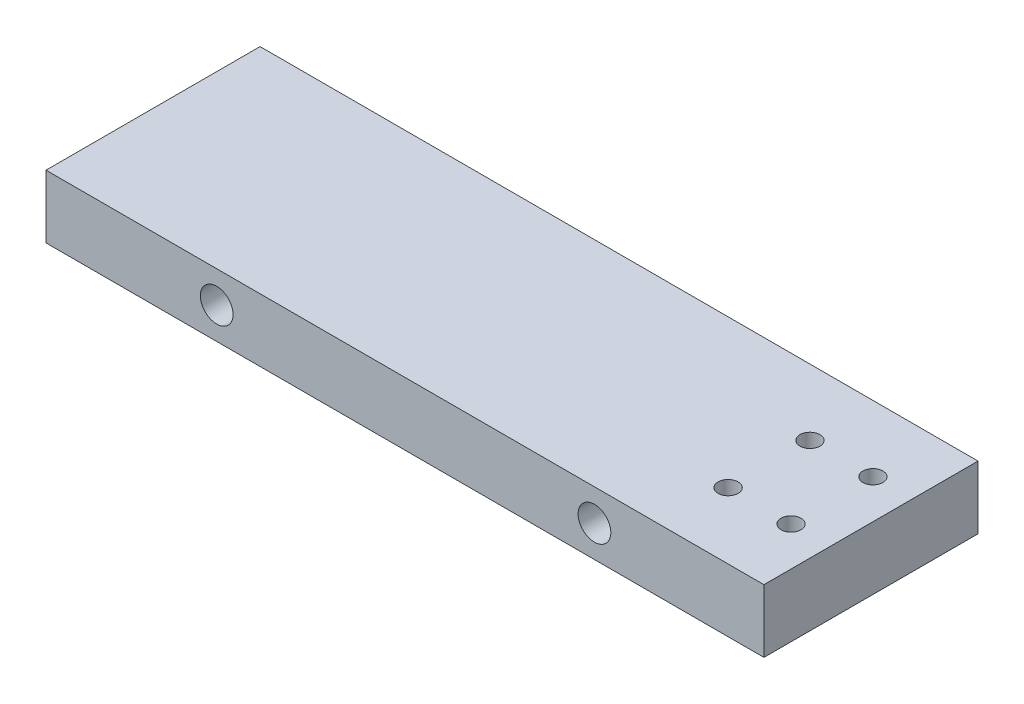
from build123d import *

# Parameters (mm, degrees)
SKETCH1_W           = 114.02881
SKETCH1_H           = 34
BOSS_EXTRUDE1_DEPTH = 10.01
SKETCH8_R           = 2.6
CUT_EXTRUDE3_DEPTH  = 120.410090068
SKETCH11_R          = 1.59
CUT_EXTRUDE6_DEPTH  = 120.410090068
SKETCH12_W          = 34
SKETCH12_H          = 10.01
BOSS_EXTRUDE2_DEPTH = 2.69
SKETCH14_W          = 34
SKETCH14_H          = 10.01
CUT_EXTRUDE7_DEPTH  = 2.69


with BuildPart() as part:
    # Sketch1 → Boss-Extrude1 (new body)
    with BuildSketch(Plane(origin=(0, 0, 0), x_dir=(1, 0, 0), z_dir=(0, 1, 0))):
        with Locations((57.014405, 17)):
            Rectangle(SKETCH1_W, SKETCH1_H)
    extrude(amount=BOSS_EXTRUDE1_DEPTH)

    # Sketch8 → Cut-Extrude3 (cut, through all)
    with BuildSketch(Plane(origin=(0, 0, -34), x_dir=(-1, 0, 0), z_dir=(0, 0, -1))):
        with Locations((-89.8, 5)):
            Circle(SKETCH8_R)
        with Locations((-29.8, 5)):
            Circle(SKETCH8_R)
    extrude(amount=-CUT_EXTRUDE3_DEPTH, mode=Mode.SUBTRACT)

    # Sketch11 → Cut-Extrude6 (cut, through all)
    with BuildSketch(Plane(origin=(0, 10.01, 0), x_dir=(1, 0, 0), z_dir=(0, 1, 0))):
        with Locations(Location((110.52881, 10.5, 0), (0, 0, 270))):
            Circle(SKETCH11_R)
        with Locations(Location((110.52881, 23.5, 0), (0, 0, 270))):
            Circle(SKETCH11_R)
        with Locations(Location((100.52881, 10.5, 0), (0, 0, 270))):
            Circle(SKETCH11_R)
        with Locations(Location((100.52881, 23.5, 0), (0, 0, 270))):
            Circle(SKETCH11_R)
    extrude(amount=-CUT_EXTRUDE6_DEPTH, mode=Mode.SUBTRACT)

    # Sketch12 → Boss-Extrude2 (add)
    with BuildSketch(Plane(origin=(114.02881, 0, 0), x_dir=(0, 0, -1), z_dir=(1, 0, 0))):
        with Locations((17, 5.005)):
            Rectangle(SKETCH12_W, SKETCH12_H)
    extrude(amount=BOSS_EXTRUDE2_DEPTH)

    # Sketch14 → Cut-Extrude7 (cut)
    with BuildSketch(Plane.ZY):
        with Locations((-17, 5.005)):
            Rectangle(SKETCH14_W, SKETCH14_H)
    extrude(amount=-CUT_EXTRUDE7_DEPTH, mode=Mode.SUBTRACT)


solid = part.part
